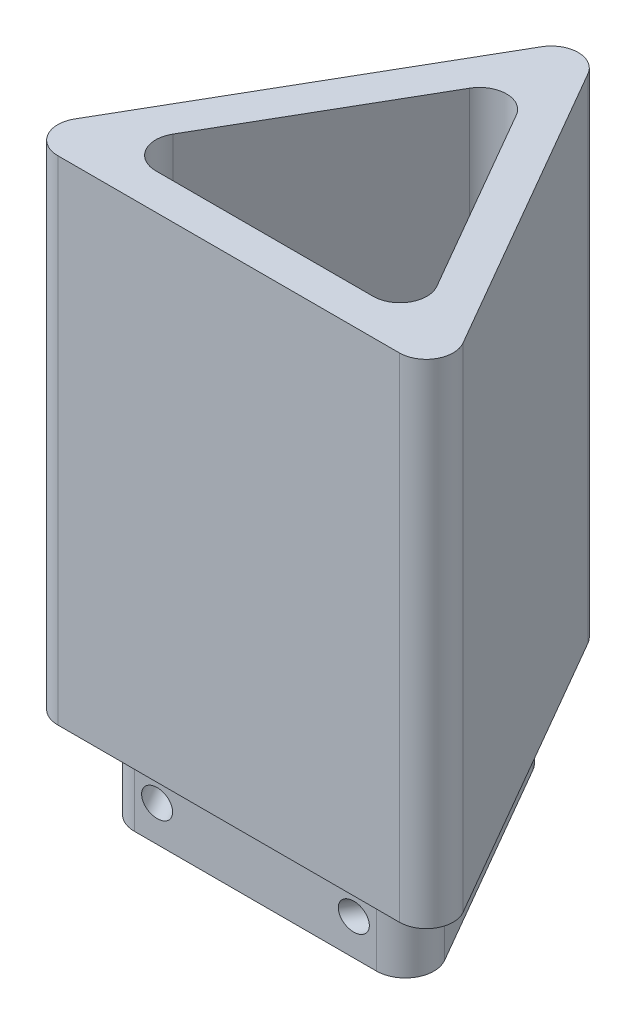
from build123d import *

# Parameters (mm, degrees)
EXTRUDE_1_DEPTH          = 9
EXTRUDE_2_DEPTH          = 5
FILLET_1_R               = 3.2
SKETCH_5_R               = 1.5
CUT_EXTRUDE_1_DEPTH      = 18
PATTERN_CIRCULAR_1_COUNT = 3
FILLET_2_R               = 3
EXTRUDE_START            = 50
EXTRUDE_3_DEPTH          = 50
FILLET_3_R               = 3


with BuildPart() as part:
    # 草图1 → 凸台-拉伸1 (new body)
    with BuildSketch(Plane(origin=(0, 0, 0), x_dir=(1, 0, 0), z_dir=(0, 1, 0))):
        Polygon((0, 22), (-19.052558883, -11), (19.052558883, -11), align=None)
        Polygon((0, 12), (-10.392304845, -6), (10.392304845, -6), align=None, mode=Mode.SUBTRACT)
    extrude(amount=EXTRUDE_1_DEPTH)

    # 草图3 → 凸台-拉伸2 (add)
    with BuildSketch(Plane(origin=(0, 9, 0), x_dir=(1, 0, 0), z_dir=(0, 1, 0))):
        Polygon((0, 28), (-24.248711306, -14), (24.248711306, -14), align=None)
        Polygon((0, 12), (-10.392304845, -6), (10.392304845, -6), align=None, mode=Mode.SUBTRACT)
    extrude(amount=EXTRUDE_2_DEPTH)

    # 圆角1
    fillet_1_edges = [part.edges().sort_by_distance(p)[0] for p in [
        (19.052558883, 4.5, 11),
        (-19.052558883, 4.5, 11),
        (0, 4.5, -22),
    ]]
    fillet(fillet_1_edges, radius=FILLET_1_R)

    # 草图5 → 切除-拉伸1 (cut)
    with BuildSketch(Plane(origin=(7, -46, 0), x_dir=(0, 0, -1), z_dir=(1, 0, 0))):
        with Locations((15, 50)):
            Circle(SKETCH_5_R)
    cut_extrude_1 = extrude(amount=-CUT_EXTRUDE_1_DEPTH, mode=Mode.SUBTRACT)

    # 阵列(圆周)1: 切除-拉伸1 ×3 about axis
    pattern_circular_1_axis = Axis((0, 0, 0), (0, 1, 0))
    for i in range(1, PATTERN_CIRCULAR_1_COUNT):
        add(cut_extrude_1.rotate(pattern_circular_1_axis, i * 360 / PATTERN_CIRCULAR_1_COUNT), mode=Mode.SUBTRACT)

    # 圆角2
    fillet_2_edges = [part.edges().sort_by_distance(p)[0] for p in [
        (24.248711306, 11.5, 14),
        (0, 11.5, -28),
        (-24.248711306, 11.5, 14),
    ]]
    fillet(fillet_2_edges, radius=FILLET_2_R)

    # 草图6 → 凸台-拉伸3 (add)
    with BuildSketch(Plane(origin=(0, 14, 0), x_dir=(1, 0, 0), z_dir=(0, 1, 0)).offset(EXTRUDE_START)):
        with BuildLine():
            Line((-2.598076211, 23.5), (-21.650635095, -9.5))
            ThreePointArc((-21.650635095, -9.5), (-21.650635095, -12.5), (-19.052558883, -14))
            Line((-19.052558883, -14), (19.052558883, -14))
            ThreePointArc((19.052558883, -14), (21.650635095, -12.5), (21.650635095, -9.5))
            Line((21.650635095, -9.5), (2.598076211, 23.5))
            ThreePointArc((2.598076211, 23.5), (0, 25), (-2.598076211, 23.5))
        make_face()
        Polygon((0, 20), (-17.320508076, -10), (17.320508076, -10), align=None, mode=Mode.SUBTRACT)
    extrude(amount=-EXTRUDE_3_DEPTH)

    # 圆角3
    fillet_3_edges = [part.edges().sort_by_distance(p)[0] for p in [
        (8.660254038, 14, -5),
        (-8.660254038, 14, -5),
        (0, 14, 10),
        (0, 39, -20),
        (-17.320508076, 39, 10),
        (17.320508076, 39, 10),
    ]]
    fillet(fillet_3_edges, radius=FILLET_3_R)


solid = part.part
